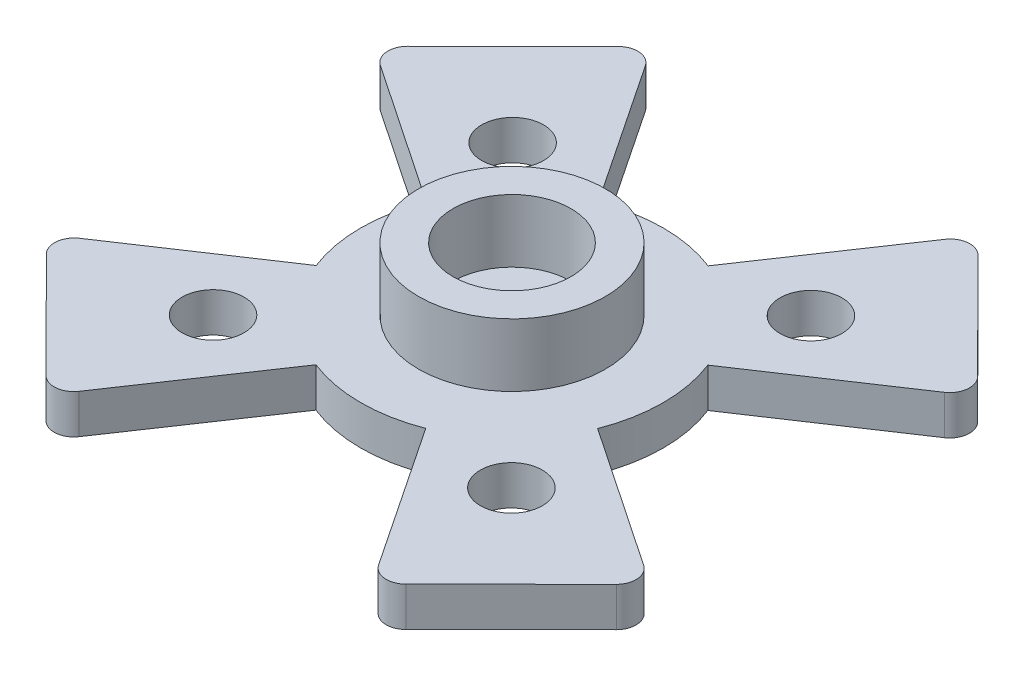
from build123d import *

# Parameters (mm, degrees)
SKETCH1_R             = 3
BOSS_EXTRUDE1_DEPTH   = 2
SKETCH1_R_2           = 4.75
SKETCH1_R_3           = 1.575
BOSS_EXTRUDE1_2_DEPTH = 2
SKETCH1_3_R           = 4.75
SKETCH1_3_R_2         = 3
BOSS_EXTRUDE2_DEPTH   = 5.2
FILLET1_R             = 1


with BuildPart() as part:
    # Sketch1 → Boss-Extrude1 (new body)
    with BuildSketch(Plane(origin=(0, 0, 0), x_dir=(1, 0, 0), z_dir=(0, 1, 0))):
        Circle(SKETCH1_R)
    extrude(amount=BOSS_EXTRUDE1_DEPTH)



with BuildPart() as body_2:
    # Sketch1 → Boss-Extrude1 2 (new body)
    with BuildSketch(Plane(origin=(0, 0, 0), x_dir=(1, 0, 0), z_dir=(0, 1, 0))):
        with BuildLine():
            ThreePointArc((-2.808735927, -7.163433576), (-0.01229774, -7.694389311), (2.785823381, -7.172375213))
            Line((2.785823381, -7.172375213), (8.27733707, -15.397108965))
            Line((8.27733707, -15.397108965), (15.361972878, -8.339635234))
            Line((15.361972878, -8.339635234), (7.163433576, -2.808735927))
            ThreePointArc((7.163433576, -2.808735927), (7.694389311, -0.01229774), (7.172375213, 2.785823381))
            Line((7.172375213, 2.785823381), (15.397108965, 8.27733707))
            Line((15.397108965, 8.27733707), (8.339635234, 15.361972878))
            Line((8.339635234, 15.361972878), (2.808735927, 7.163433576))
            ThreePointArc((2.808735927, 7.163433576), (0.01229774, 7.694389311), (-2.785823381, 7.172375213))
            Line((-2.785823381, 7.172375213), (-8.27733707, 15.397108965))
            Line((-8.27733707, 15.397108965), (-15.361972878, 8.339635234))
            Line((-15.361972878, 8.339635234), (-7.163433576, 2.808735927))
            ThreePointArc((-7.163433576, 2.808735927), (-7.694389311, 0.01229774), (-7.172375213, -2.785823381))
            Line((-7.172375213, -2.785823381), (-15.397108965, -8.27733707))
            Line((-15.397108965, -8.27733707), (-8.339635234, -15.361972878))
            Line((-8.339635234, -15.361972878), (-2.808735927, -7.163433576))
        make_face()
        Circle(SKETCH1_R_2, mode=Mode.SUBTRACT)
        with Locations((-7.61701493, -7.585748715)):
            Circle(SKETCH1_R_3, mode=Mode.SUBTRACT)
        with Locations((7.585748715, -7.61701493)):
            Circle(SKETCH1_R_3, mode=Mode.SUBTRACT)
        with Locations((-7.585748715, 7.61701493)):
            Circle(SKETCH1_R_3, mode=Mode.SUBTRACT)
        with Locations((7.61701493, 7.585748715)):
            Circle(SKETCH1_R_3, mode=Mode.SUBTRACT)
    extrude(amount=BOSS_EXTRUDE1_2_DEPTH)


with BuildPart() as part_1:
    add(part.part)

    add(body_2.part)  # Boss-Extrude2 merges body 2
    # Sketch1<3> → Boss-Extrude2 (add)
    with BuildSketch(Plane(origin=(0, 0, 0), x_dir=(1, 0, 0), z_dir=(0, 1, 0))):
        Circle(SKETCH1_3_R)
        Circle(SKETCH1_3_R_2, mode=Mode.SUBTRACT)
    extrude(amount=BOSS_EXTRUDE2_DEPTH)

    # Fillet1
    fillet1_edges = [part_1.edges().sort_by_distance(p)[0] for p in [
        (-15.361972878, 1, -8.339635234),
        (-8.27733707, 1, -15.397108965),
        (8.339635234, 1, -15.361972878),
        (15.361972878, 1, 8.339635234),
        (15.397108965, 1, -8.27733707),
        (8.27733707, 1, 15.397108965),
        (-15.397108965, 1, 8.27733707),
        (-8.339635234, 1, 15.361972878),
    ]]
    fillet(fillet1_edges, radius=FILLET1_R)


solid = part_1.part
